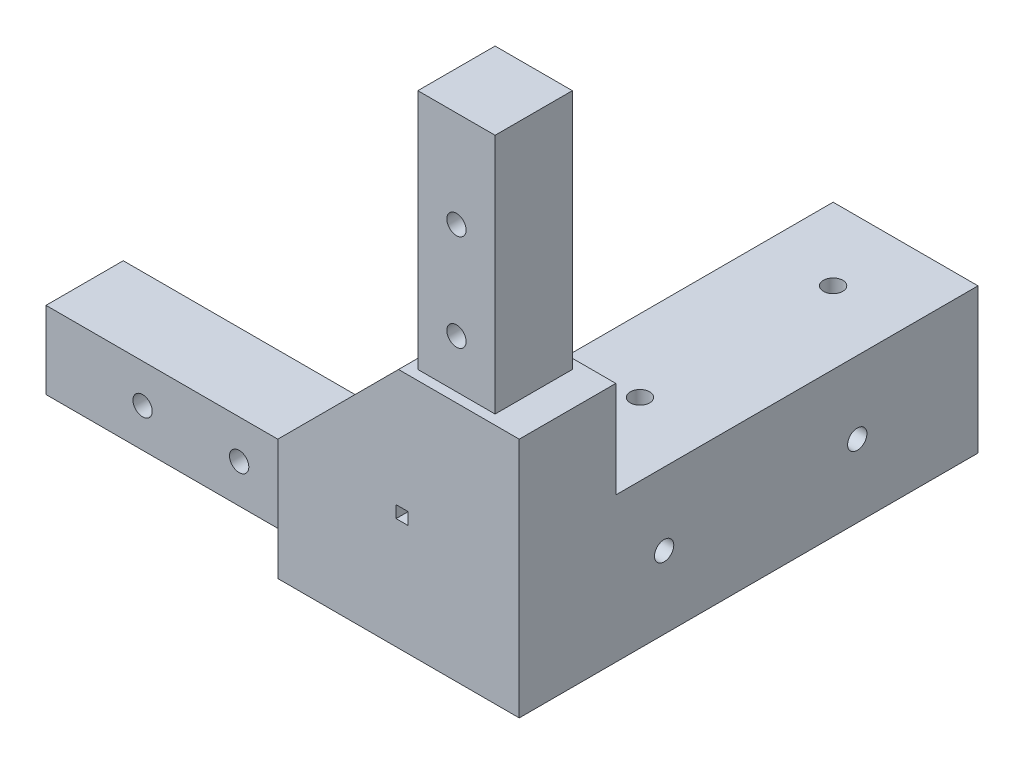
from build123d import *

# Parameters (mm, degrees)
SKETCH1_W           = 100
SKETCH1_H           = 100
BOSS_EXTRUDE1_DEPTH = 100
CUT_EXTRUDE16_DEPTH = 70
SKETCH8_W           = 70
SKETCH8_H           = 70
CUT_EXTRUDE17_DEPTH = 30
SKETCH9_W           = 21
SKETCH9_H           = 21
CUT_EXTRUDE20_DEPTH = 90
SKETCH10_W          = 30
SKETCH10_H          = 30
SKETCH10_W_2        = 16
SKETCH10_H_2        = 16
CUT_EXTRUDE21_DEPTH = 50
SKETCH11_W          = 30
SKETCH11_H          = 30
SKETCH11_W_2        = 20
SKETCH11_H_2        = 20
CUT_EXTRUDE22_DEPTH = 20
SKETCH12_W          = 30
SKETCH12_H          = 30
SKETCH12_W_2        = 20
SKETCH12_H_2        = 20
CUT_EXTRUDE23_DEPTH = 70
SKETCH13_W          = 20
SKETCH13_H          = 20
SKETCH13_W_2        = 16
SKETCH13_H_2        = 16
CUT_EXTRUDE24_DEPTH = 50
SKETCH15_R          = 2
CUT_EXTRUDE25_DEPTH = 30
SKETCH16_R          = 2
CUT_EXTRUDE26_DEPTH = 30
SKETCH17_R          = 2
CUT_EXTRUDE27_DEPTH = 16
SKETCH18_R          = 2
CUT_EXTRUDE29_DEPTH = 16
SKETCH19_W          = 30
SKETCH19_H          = 30
CUT_EXTRUDE30_DEPTH = 5
BOSS_EXTRUDE2_DEPTH = 20
SKETCH21_W          = 20
SKETCH21_H          = 7
BOSS_EXTRUDE6_DEPTH = 24
SKETCH22_W          = 2.5
SKETCH22_H          = 2.5
CUT_EXTRUDE31_DEPTH = 20
SKETCH23_W          = 7
SKETCH23_H          = 20
BOSS_EXTRUDE7_DEPTH = 24


with BuildPart() as part:
    # Sketch1 → Boss-Extrude1 (new body)
    with BuildSketch(Plane.XY):
        Rectangle(SKETCH1_W, SKETCH1_H)
    extrude(amount=-BOSS_EXTRUDE1_DEPTH)

    # Sketch5 → Cut-Extrude16 (cut)
    with BuildSketch(Plane(origin=(0, 0, -100), x_dir=(-1, 0, 0), z_dir=(0, 0, -1))):
        Polygon((50, -50), (50, 50), (-50, 50), (-50, -20), (-20, -20), (-20, -50), align=None)
    extrude(amount=-CUT_EXTRUDE16_DEPTH, mode=Mode.SUBTRACT)

    # Sketch8 → Cut-Extrude17 (cut)
    with BuildSketch(Plane(origin=(0, 0, -30), x_dir=(-1, 0, 0), z_dir=(0, 0, -1))):
        with Locations((15, 15)):
            Rectangle(SKETCH8_W, SKETCH8_H)
    extrude(amount=-CUT_EXTRUDE17_DEPTH, mode=Mode.SUBTRACT)

    # Sketch9 → Cut-Extrude20 (cut)
    with BuildSketch(Plane(origin=(0, 0, -100), x_dir=(-1, 0, 0), z_dir=(0, 0, -1))):
        with Locations((-35, -35)):
            Rectangle(SKETCH9_W, SKETCH9_H)
    extrude(amount=-CUT_EXTRUDE20_DEPTH, mode=Mode.SUBTRACT)

    # Sketch10 → Cut-Extrude21 (cut)
    with BuildSketch(Plane.ZY.offset(50)):
        with Locations((-15, -35)):
            Rectangle(SKETCH10_W, SKETCH10_H)
        with Locations((-15, -35)):
            Rectangle(SKETCH10_W_2, SKETCH10_H_2, mode=Mode.SUBTRACT)
    extrude(amount=-CUT_EXTRUDE21_DEPTH, mode=Mode.SUBTRACT)

    # Sketch11 → Cut-Extrude22 (cut)
    with BuildSketch(Plane.ZY):
        with Locations((-15, -35)):
            Rectangle(SKETCH11_W, SKETCH11_H)
        with Locations((-15, -35)):
            Rectangle(SKETCH11_W_2, SKETCH11_H_2, mode=Mode.SUBTRACT)
    extrude(amount=-CUT_EXTRUDE22_DEPTH, mode=Mode.SUBTRACT)

    # Sketch12 → Cut-Extrude23 (cut)
    with BuildSketch(Plane(origin=(0, 50, 0), x_dir=(1, 0, 0), z_dir=(0, 1, 0))):
        with Locations((35, 15)):
            Rectangle(SKETCH12_W, SKETCH12_H)
        with Locations((35, 15)):
            Rectangle(SKETCH12_W_2, SKETCH12_H_2, mode=Mode.SUBTRACT)
    extrude(amount=-CUT_EXTRUDE23_DEPTH, mode=Mode.SUBTRACT)

    # Sketch13 → Cut-Extrude24 (cut)
    with BuildSketch(Plane(origin=(0, 50, 0), x_dir=(1, 0, 0), z_dir=(0, 1, 0))):
        with Locations((35, 15)):
            Rectangle(SKETCH13_W, SKETCH13_H)
        with Locations((35, 15)):
            Rectangle(SKETCH13_W_2, SKETCH13_H_2, mode=Mode.SUBTRACT)
    extrude(amount=-CUT_EXTRUDE24_DEPTH, mode=Mode.SUBTRACT)

    # Sketch15 → Cut-Extrude25 (cut)
    with BuildSketch(Plane(origin=(0, -20, 0), x_dir=(1, 0, 0), z_dir=(0, 1, 0))):
        with Locations(Location((35, 85, 0), (0, 0, 270))):
            Circle(SKETCH15_R)
        with Locations(Location((35, 45, 0), (0, 0, 270))):
            Circle(SKETCH15_R)
    extrude(amount=-CUT_EXTRUDE25_DEPTH, mode=Mode.SUBTRACT)

    # Sketch16 → Cut-Extrude26 (cut)
    with BuildSketch(Plane(origin=(50, 0, 0), x_dir=(0, 0, -1), z_dir=(1, 0, 0))):
        with Locations((75, -35)):
            Circle(SKETCH16_R)
        with Locations((35, -35)):
            Circle(SKETCH16_R)
    extrude(amount=-CUT_EXTRUDE26_DEPTH, mode=Mode.SUBTRACT)

    # Sketch17 → Cut-Extrude27 (cut)
    with BuildSketch(Plane(origin=(0, 0, -23), x_dir=(-1, 0, 0), z_dir=(0, 0, -1))):
        with Locations((-35, 30)):
            Circle(SKETCH17_R)
        with Locations((-35, 10)):
            Circle(SKETCH17_R)
    extrude(amount=-CUT_EXTRUDE27_DEPTH, mode=Mode.SUBTRACT)

    # Sketch18 → Cut-Extrude29 (cut)
    with BuildSketch(Plane(origin=(0, 0, -23), x_dir=(-1, 0, 0), z_dir=(0, 0, -1))):
        with Locations((30, -35)):
            Circle(SKETCH18_R)
        with Locations((10, -35)):
            Circle(SKETCH18_R)
    extrude(amount=-CUT_EXTRUDE29_DEPTH, mode=Mode.SUBTRACT)

    # Sketch19 → Cut-Extrude30 (cut)
    with BuildSketch(Plane.XY):
        with Locations((35, -35)):
            Rectangle(SKETCH19_W, SKETCH19_H)
    extrude(amount=-CUT_EXTRUDE30_DEPTH, mode=Mode.SUBTRACT)

    # Sketch20 → Boss-Extrude2 (add)
    with BuildSketch(Plane.XY.offset(-5)):
        Polygon((25, 0), (0, -25), (0, -27), (27, -27), (27, 0), align=None)
    extrude(amount=-BOSS_EXTRUDE2_DEPTH)

    # Sketch21 → Boss-Extrude6 (add)
    with BuildSketch(Plane.ZY):
        with Locations((-15, -46.5)):
            Rectangle(SKETCH21_W, SKETCH21_H)
    extrude(amount=-BOSS_EXTRUDE6_DEPTH)

    # Sketch22 → Cut-Extrude31 (cut)
    with BuildSketch(Plane(origin=(0, 0, -25), x_dir=(-1, 0, 0), z_dir=(0, 0, -1))):
        with Locations((-25.75, -25.75)):
            Rectangle(SKETCH22_W, SKETCH22_H)
    extrude(amount=-CUT_EXTRUDE31_DEPTH, mode=Mode.SUBTRACT)

    # Sketch23 → Boss-Extrude7 (add)
    with BuildSketch(Plane(origin=(0, 0, 0), x_dir=(1, 0, 0), z_dir=(0, 1, 0))):
        with Locations((46.5, 15)):
            Rectangle(SKETCH23_W, SKETCH23_H)
    extrude(amount=-BOSS_EXTRUDE7_DEPTH)


solid = part.part
